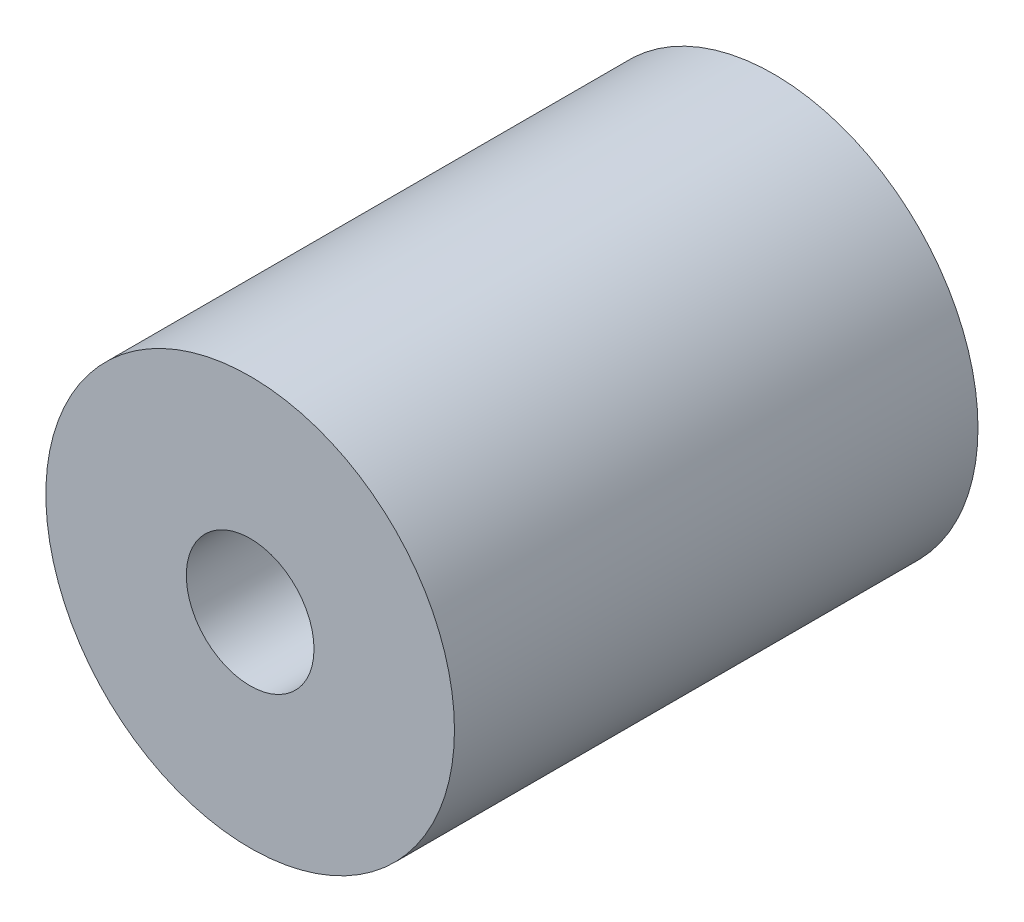
from build123d import *

# Parameters (mm, degrees)
SKETCH_1_R          = 16
EXTRUDE_1_DEPTH     = 41
SKETCH_2_R          = 5
CUT_EXTRUDE_1_DEPTH = 47.829477896
SKETCH_3_R          = 7
CUT_EXTRUDE_2_DEPTH = 12


with BuildPart() as part:
    # 草图1 → 凸台-拉伸1 (new body)
    with BuildSketch(Plane.XY):
        Circle(SKETCH_1_R)
    extrude(amount=EXTRUDE_1_DEPTH)

    # 草图2 → 切除-拉伸1 (cut, through all)
    with BuildSketch(Plane.XY.offset(41)):
        Circle(SKETCH_2_R)
    extrude(amount=-CUT_EXTRUDE_1_DEPTH, mode=Mode.SUBTRACT)

    # 草图3 → 切除-拉伸2 (cut)
    with BuildSketch(Plane(origin=(0, 0, 0), x_dir=(-1, 0, 0), z_dir=(0, 0, -1))):
        Circle(SKETCH_3_R)
    extrude(amount=-CUT_EXTRUDE_2_DEPTH, mode=Mode.SUBTRACT)


solid = part.part
